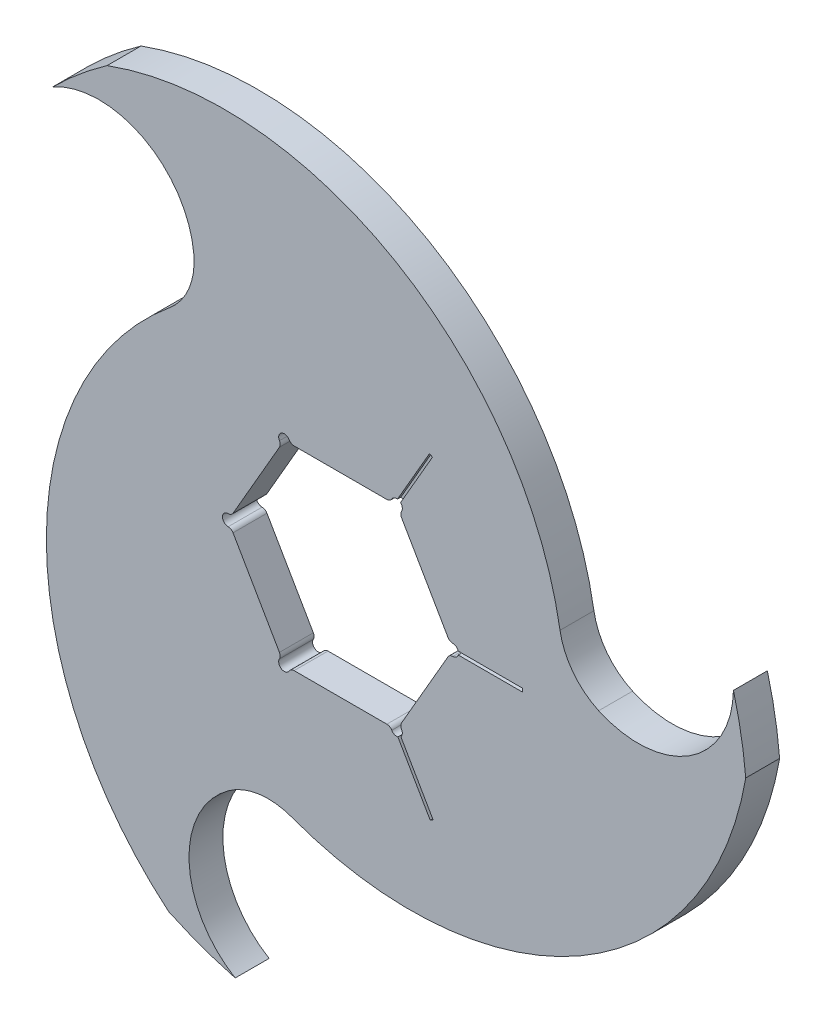
from build123d import *

# Parameters (mm, degrees)
BOSS_EXTRUDE1_DEPTH = 2.5
FILLET1_R           = 10
CUT_EXTRUDE1_DEPTH  = 0.5


with BuildPart() as part:
    # Sketch1 → Boss-Extrude1 (new, symmetric)
    with BuildSketch(Plane.XY):
        with BuildLine():
            ThreePointArc((-34.426436475, 49.140822863), (-38.572797774, 45.958016405), (-42.426406871, 42.426406871))
            ThreePointArc((-42.426406871, 42.426406871), (-26.29235792, 40.654943242), (-22.609103215, 24.847373735))
            ThreePointArc((-22.609103215, 24.847373735), (-43.353983992, -14.099744614), (-25.343982725, -54.38457998))
            ThreePointArc((-25.343982725, -54.38457998), (-20.514410827, -56.38403097), (-15.529142706, -57.955549577))
            ThreePointArc((-15.529142706, -57.955549577), (-22.062034677, -43.097321505), (-10.213905264, -32.003744609))
            ThreePointArc((-10.213905264, -32.003744609), (33.887729018, -30.495779185), (59.7704192, 5.243757117))
            ThreePointArc((59.7704192, 5.243757117), (59.087208601, 10.426014565), (57.955549577, 15.529142706))
            ThreePointArc((57.955549577, 15.529142706), (48.354392597, 2.442378263), (32.82300848, 7.156370874))
            ThreePointArc((32.82300848, 7.156370874), (9.466254973, 44.595523799), (-34.426436475, 49.140822863))
        make_face()
        with BuildLine():
            Line((-15.848264889, -1.25), (-9.006664199, -13.1))
            ThreePointArc((-9.006664199, -13.1), (-8.895018703, -13.516666667), (-9.006664199, -13.933333333))
            ThreePointArc((-9.006664199, -13.933333333), (-8.70164303, -15.071687836), (-7.563288526, -14.766666667))
            ThreePointArc((-7.563288526, -14.766666667), (-7.258267357, -14.461645497), (-6.84160069, -14.35))
            Line((-6.84160069, -14.35), (6.84160069, -14.35))
            ThreePointArc((6.84160069, -14.35), (7.258267357, -14.461645497), (7.563288526, -14.766666667))
            ThreePointArc((7.563288526, -14.766666667), (8.70164303, -15.071687836), (9.006664199, -13.933333333))
            ThreePointArc((9.006664199, -13.933333333), (8.895018703, -13.516666667), (9.006664199, -13.1))
            Line((9.006664199, -13.1), (15.848264889, -1.25))
            ThreePointArc((15.848264889, -1.25), (16.153286059, -0.94497883), (16.569952726, -0.833333333))
            ThreePointArc((16.569952726, -0.833333333), (17.403286059, 0), (16.569952726, 0.833333333))
            ThreePointArc((16.569952726, 0.833333333), (16.153286059, 0.94497883), (15.848264889, 1.25))
            Line((15.848264889, 1.25), (9.006664199, 13.1))
            ThreePointArc((9.006664199, 13.1), (8.895018703, 13.516666667), (9.006664199, 13.933333333))
            ThreePointArc((9.006664199, 13.933333333), (8.70164303, 15.071687836), (7.563288526, 14.766666667))
            ThreePointArc((7.563288526, 14.766666667), (7.258267357, 14.461645497), (6.84160069, 14.35))
            Line((6.84160069, 14.35), (-6.84160069, 14.35))
            ThreePointArc((-6.84160069, 14.35), (-7.258267357, 14.461645497), (-7.563288526, 14.766666667))
            ThreePointArc((-7.563288526, 14.766666667), (-8.70164303, 15.071687836), (-9.006664199, 13.933333333))
            ThreePointArc((-9.006664199, 13.933333333), (-8.895018703, 13.516666667), (-9.006664199, 13.1))
            Line((-9.006664199, 13.1), (-15.848264889, 1.25))
            ThreePointArc((-15.848264889, 1.25), (-16.153286059, 0.94497883), (-16.569952726, 0.833333333))
            ThreePointArc((-16.569952726, 0.833333333), (-17.403286059, 0), (-16.569952726, -0.833333333))
            ThreePointArc((-16.569952726, -0.833333333), (-16.153286059, -0.94497883), (-15.848264889, -1.25))
        make_face(mode=Mode.SUBTRACT)
    extrude(amount=BOSS_EXTRUDE1_DEPTH, both=True)

    # Fillet1
    fillet1_edges = [part.edges().sort_by_distance(p)[0] for p in [
        (32.82300848, 7.156370874, 0),
        (-10.213905264, -32.003744609, 0),
        (-22.609103215, 24.847373735, 0),
    ]]
    fillet(fillet1_edges, radius=FILLET1_R)

    # Sketch2 → Cut-Extrude1 (cut)
    with BuildSketch(Plane.XY.offset(2.5)):
        Polygon((8.66814938, -14.513675135), (13.66814938, -23.173929172), (13.235136679, -23.423929172), (8.235136679, -14.763675135), align=None)
        Polygon((16.834018905, -0.25029747), (16.834004031, 0.249702529), (26.834004027, 0.25), (26.8340189, -0.25), align=None)
        Polygon((8.564068882, 14.452995813), (8.131041308, 14.702970051), (13.130526065, 23.363521544), (13.563553639, 23.113547307), align=None)
    extrude(amount=-CUT_EXTRUDE1_DEPTH, mode=Mode.SUBTRACT)


solid = part.part
